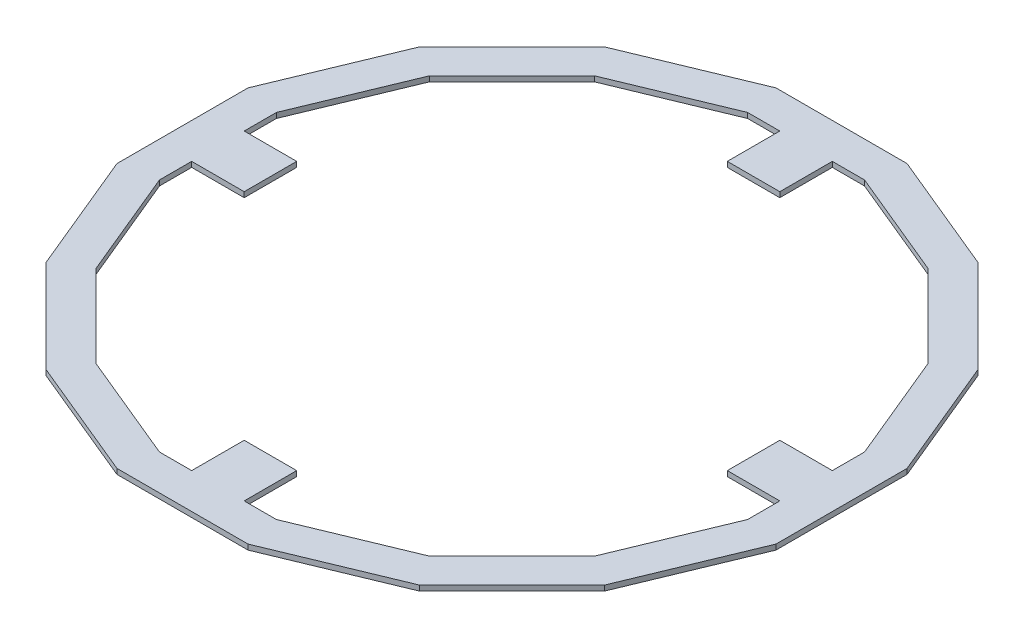
from build123d import *

# Parameters (mm, degrees)
BOSS_EXTRUDE1_DEPTH = 1
SKETCH2_W           = 10
SKETCH2_H           = 10
BOSS_EXTRUDE2_DEPTH = 1


with BuildPart() as part:
    # Sketch1 → Boss-Extrude1 (new body)
    with BuildSketch(Plane(origin=(0, 0, 0), x_dir=(1, 0, 0), z_dir=(0, 1, 0))):
        Polygon((62.75, -12.481751053), (62.75, 12.481751053), (53.19688133, 35.545019709), (35.545019709, 53.19688133), (12.481751053, 62.75), (-12.481751053, 62.75), (-35.545019709, 53.19688133), (-53.19688133, 35.545019709), (-62.75, 12.481751053), (-62.75, -12.481751053), (-53.19688133, -35.545019709), (-35.545019709, -53.19688133), (-12.481751053, -62.75), (12.481751053, -62.75), (35.545019709, -53.19688133), (53.19688133, -35.545019709), align=None)
        Polygon((56, -11.139092573), (56, 11.139092573), (47.474507641, 31.721451852), (31.721451852, 47.474507641), (11.139092573, 56), (-11.139092573, 56), (-31.721451852, 47.474507641), (-47.474507641, 31.721451852), (-56, 11.139092573), (-56, -11.139092573), (-47.474507641, -31.721451852), (-31.721451852, -47.474507641), (-11.139092573, -56), (11.139092573, -56), (31.721451852, -47.474507641), (47.474507641, -31.721451852), align=None, mode=Mode.SUBTRACT)
    extrude(amount=BOSS_EXTRUDE1_DEPTH)

    # Sketch2 → Boss-Extrude2 (add)
    with BuildSketch(Plane(origin=(0, 1, 0), x_dir=(1, 0, 0), z_dir=(0, 1, 0))):
        with Locations((0, -51)):
            Rectangle(SKETCH2_W, SKETCH2_H)
        with Locations((-51, 0)):
            Rectangle(SKETCH2_W, SKETCH2_H)
        with Locations((0, 51)):
            Rectangle(SKETCH2_W, SKETCH2_H)
        with Locations((51, 0)):
            Rectangle(SKETCH2_W, SKETCH2_H)
    extrude(amount=-BOSS_EXTRUDE2_DEPTH)


solid = part.part
